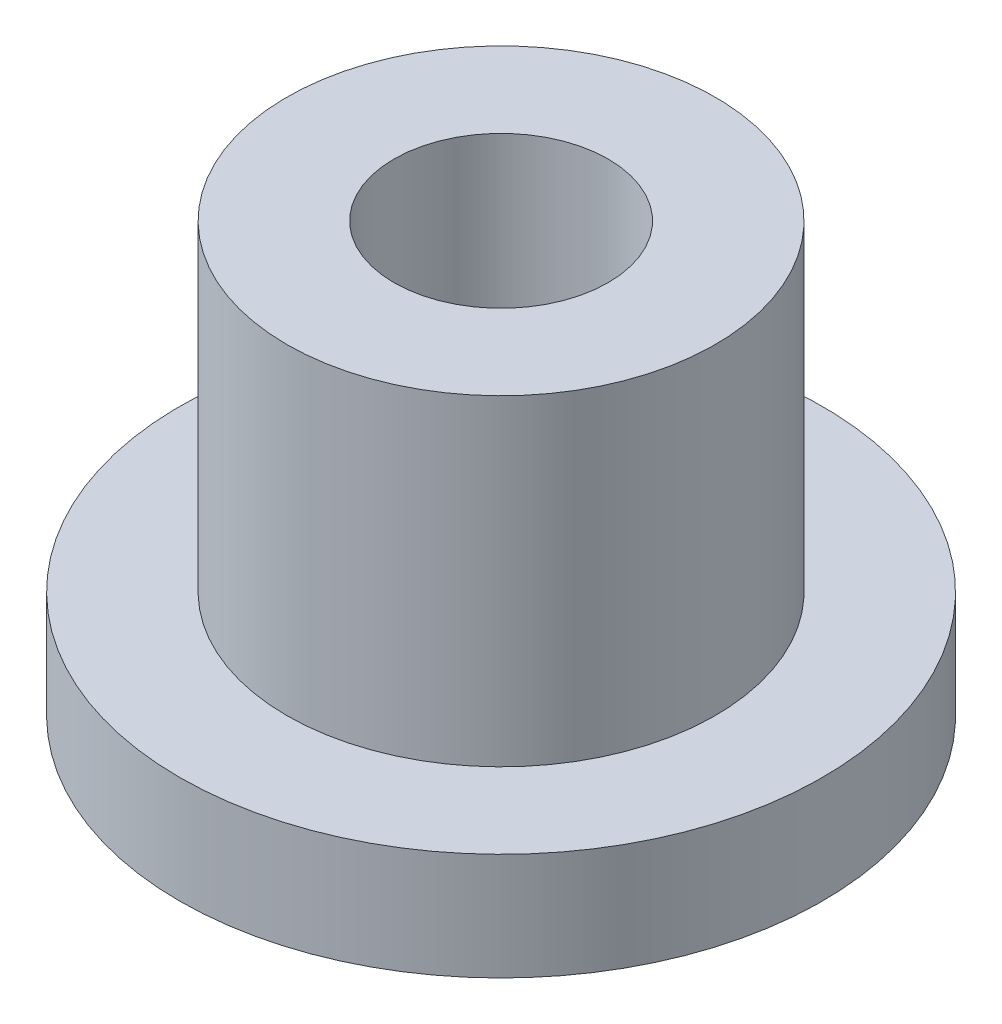
from build123d import *

# Parameters (mm, degrees)
SKETCH1_R           = 6
SKETCH1_R_2         = 4
BOSS_EXTRUDE1_DEPTH = 2
SKETCH1_3_R         = 4
SKETCH1_3_R_2       = 2
BOSS_EXTRUDE2_DEPTH = 8


with BuildPart() as part:
    # Sketch1 → Boss-Extrude1 (new body)
    with BuildSketch(Plane(origin=(0, 0, 0), x_dir=(1, 0, 0), z_dir=(0, 1, 0))):
        Circle(SKETCH1_R)
        Circle(SKETCH1_R_2, mode=Mode.SUBTRACT)
    extrude(amount=BOSS_EXTRUDE1_DEPTH)

    # Sketch1<3> → Boss-Extrude2 (add)
    with BuildSketch(Plane(origin=(0, 0, 0), x_dir=(1, 0, 0), z_dir=(0, 1, 0))):
        Circle(SKETCH1_3_R)
        Circle(SKETCH1_3_R_2, mode=Mode.SUBTRACT)
    extrude(amount=BOSS_EXTRUDE2_DEPTH)


solid = part.part
